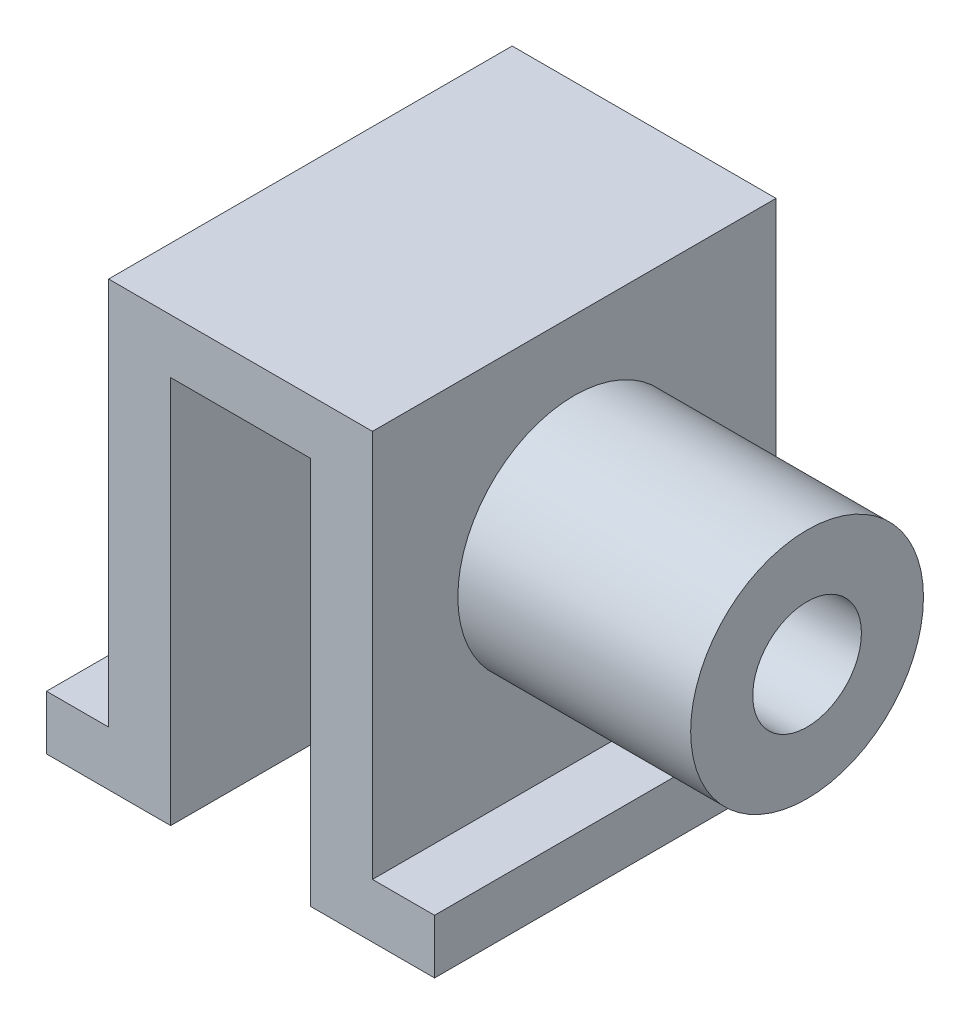
from build123d import *

# Parameters (mm, degrees)
SKETCH1_W           = 50
SKETCH1_H           = 57
BOSS_EXTRUDE1_DEPTH = 52
SKETCH2_W           = 18
SKETCH2_H           = 50
CUT_EXTRUDE1_DEPTH  = 52
SKETCH3_W           = 8
SKETCH3_H           = 50
CUT_EXTRUDE2_DEPTH  = 52
SKETCH4_R           = 15
SKETCH4_R_2         = 7
BOSS_EXTRUDE2_DEPTH = 30


with BuildPart() as part:
    # Sketch1 → Boss-Extrude1 (new body)
    with BuildSketch(Plane.XY):
        with Locations((25, 28.5)):
            Rectangle(SKETCH1_W, SKETCH1_H)
    extrude(amount=-BOSS_EXTRUDE1_DEPTH)

    # Sketch2 → Cut-Extrude1 (cut)
    with BuildSketch(Plane.XY):
        with Locations((25, 25)):
            Rectangle(SKETCH2_W, SKETCH2_H)
    extrude(amount=-CUT_EXTRUDE1_DEPTH, mode=Mode.SUBTRACT)

    # Sketch3 → Cut-Extrude2 (cut)
    with BuildSketch(Plane.XY):
        with Locations((46, 32)):
            Rectangle(SKETCH3_W, SKETCH3_H)
        with Locations((4, 32)):
            Rectangle(SKETCH3_W, SKETCH3_H)
    extrude(amount=-CUT_EXTRUDE2_DEPTH, mode=Mode.SUBTRACT)

    # Sketch4 → Boss-Extrude2 (add)
    with BuildSketch(Plane(origin=(42, 0, 0), x_dir=(0, 0, -1), z_dir=(1, 0, 0))):
        with Locations(Location((26, 33, 0), (0, 0, 180))):
            Circle(SKETCH4_R)
        with Locations((26, 33)):
            Circle(SKETCH4_R_2, mode=Mode.SUBTRACT)
    extrude(amount=BOSS_EXTRUDE2_DEPTH)


solid = part.part
